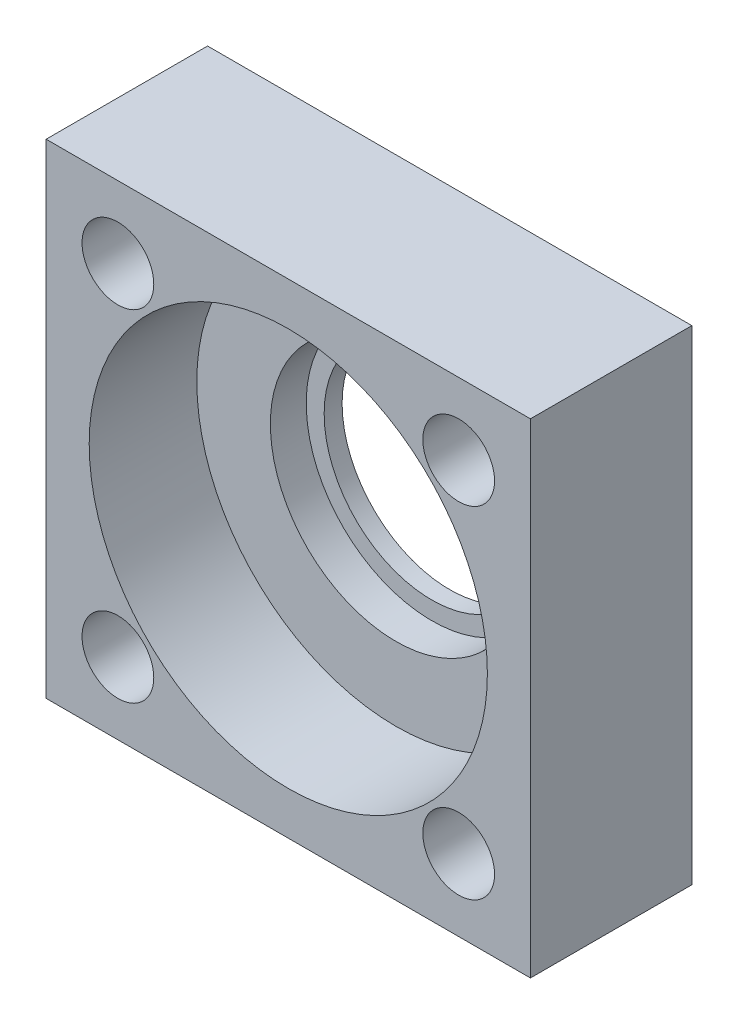
from build123d import *

# Parameters (mm, degrees)
SKETCH1_W           = 135
SKETCH1_H           = 135
BOSS_EXTRUDE1_DEPTH = 45
SKETCH2_R           = 10
SKETCH2_R_2         = 30
CUT_EXTRUDE1_DEPTH  = 106.534354596
SKETCH3_R           = 55.5
CUT_EXTRUDE2_DEPTH  = 30
SKETCH4_R           = 35
CUT_EXTRUDE3_DEPTH  = 10


with BuildPart() as part:
    # Sketch1 → Boss-Extrude1 (new body)
    with BuildSketch(Plane.XY):
        Rectangle(SKETCH1_W, SKETCH1_H)
    extrude(amount=BOSS_EXTRUDE1_DEPTH)

    # Sketch2 → Cut-Extrude1 (cut, through all)
    with BuildSketch(Plane.XY.offset(45)):
        with Locations((-47.5, 47.5)):
            Circle(SKETCH2_R)
        with Locations((47.5, 47.5)):
            Circle(SKETCH2_R)
        with Locations((47.5, -47.5)):
            Circle(SKETCH2_R)
        with Locations((-47.5, -47.5)):
            Circle(SKETCH2_R)
        Circle(SKETCH2_R_2)
    extrude(amount=-CUT_EXTRUDE1_DEPTH, mode=Mode.SUBTRACT)

    # Sketch3 → Cut-Extrude2 (cut)
    with BuildSketch(Plane.XY.offset(45)):
        Circle(SKETCH3_R)
    extrude(amount=-CUT_EXTRUDE2_DEPTH, mode=Mode.SUBTRACT)

    # Sketch4 → Cut-Extrude3 (cut)
    with BuildSketch(Plane.XY.offset(15)):
        Circle(SKETCH4_R)
    extrude(amount=-CUT_EXTRUDE3_DEPTH, mode=Mode.SUBTRACT)


solid = part.part
